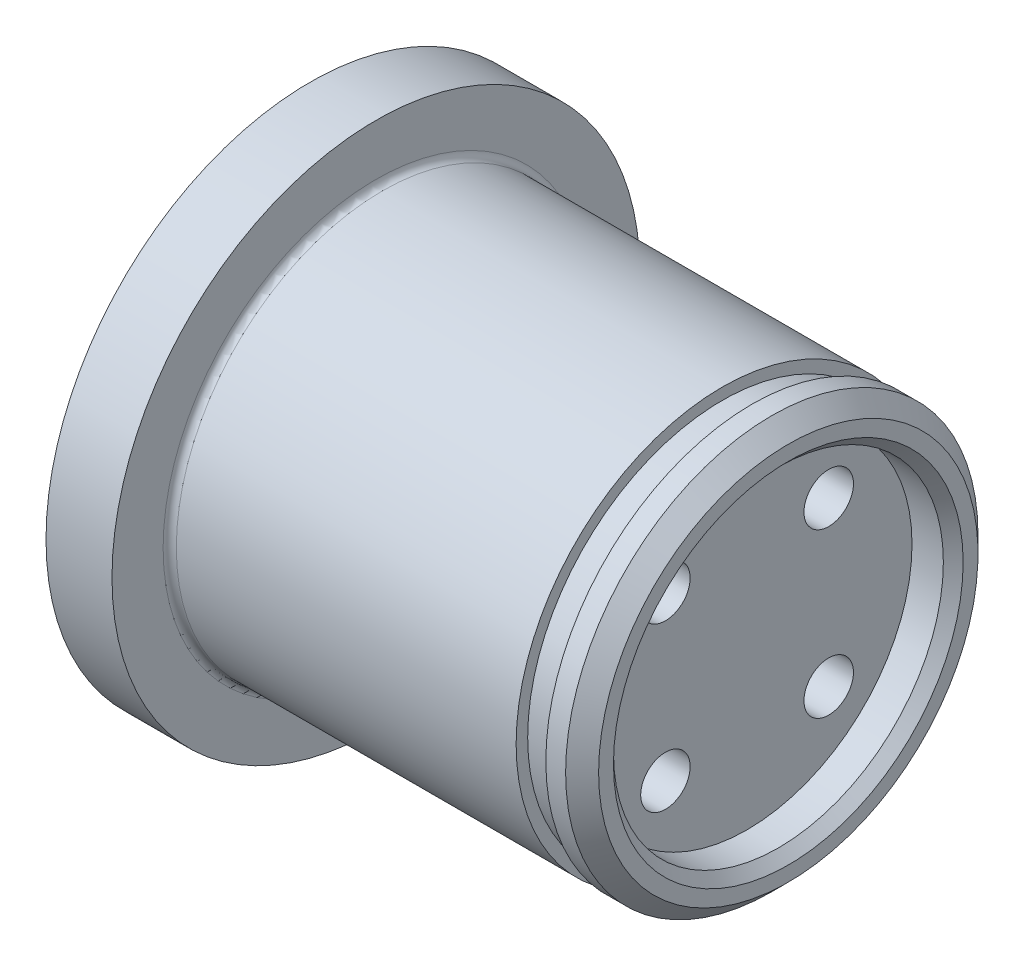
from build123d import *

# Parameters (mm, degrees)
SKETCH_2_W               = 1.8
SKETCH_2_H               = 0.7
CHAMFER_1_SIZE           = 1
FILLET_1_R               = 0.4
HOLE_WIZARD_1_D          = 3
PATTERN_CIRCULAR_1_COUNT = 4
SKETCH_5_W               = 2.5
SKETCH_5_H               = 10
CHAMFER_2_SIZE           = 0.6


with BuildPart() as part:
    # Эскиз1 → Повернуть1 (revolve)
    with BuildSketch(Plane.XY, mode=Mode.PRIVATE) as revolve_1_sk:
        Polygon((0, 0), (0, 12.5), (-25, 12.5), (-25, 16), (-29, 16), (-29, 0), align=None)
    revolve(revolve_1_sk.sketch.rotate(Axis((0, 0, 0), (1, 0, 0)), 90), axis=Axis((0, 0, 0), (1, 0, 0)))

    # Эскиз2 → Вырез-Повернуть1 (revolve, cut)
    with BuildSketch(Plane.XY, mode=Mode.PRIVATE) as cut_revolve_1_sk:
        with Locations((-3.1, 12.15)):
            Rectangle(SKETCH_2_W, SKETCH_2_H)
    revolve(cut_revolve_1_sk.sketch.rotate(Axis((0, 0, 0), (-1, 0, 0)), 270), axis=Axis((0, 0, 0), (-1, 0, 0)), mode=Mode.SUBTRACT)

    # Фаска1
    chamfer_1_edges = [part.edges().sort_by_distance(p)[0] for p in [
        (0, 0, -12.5),
    ]]
    chamfer(chamfer_1_edges, length=CHAMFER_1_SIZE)

    # Скругление1
    fillet_1_edges = [part.edges().sort_by_distance(p)[0] for p in [
        (-25, 0, -12.5),
    ]]
    fillet(fillet_1_edges, radius=FILLET_1_R)

    # Отверстие1 (through all)
    with Locations(Plane(origin=(0, 0, 0), x_dir=(0, 0, -1), z_dir=(1, 0, 0))):
        with Locations((4.949747468, 4.949747468)):
            hole_wizard_1 = Hole(HOLE_WIZARD_1_D / 2)

    # Круговой массив1: Отверстие1 ×4 about axis
    pattern_circular_1_axis = Axis((0, 0, 0), (1, 0, 0))
    for i in range(1, PATTERN_CIRCULAR_1_COUNT):
        add(hole_wizard_1.rotate(pattern_circular_1_axis, i * 360 / PATTERN_CIRCULAR_1_COUNT), mode=Mode.SUBTRACT)

    # Эскиз5 → Вырез-Повернуть2 (revolve, cut)
    with BuildSketch(Plane.XY, mode=Mode.PRIVATE) as cut_revolve_2_sk:
        with Locations((-1.25, 5)):
            Rectangle(SKETCH_5_W, SKETCH_5_H)
    revolve(cut_revolve_2_sk.sketch.rotate(Axis((0, 0, 0), (-1, 0, 0)), 90), axis=Axis((0, 0, 0), (-1, 0, 0)), mode=Mode.SUBTRACT)

    # Фаска2
    chamfer_2_edges = [part.edges().sort_by_distance(p)[0] for p in [
        (0, 0, 10),
    ]]
    chamfer(chamfer_2_edges, length=CHAMFER_2_SIZE)


solid = part.part
